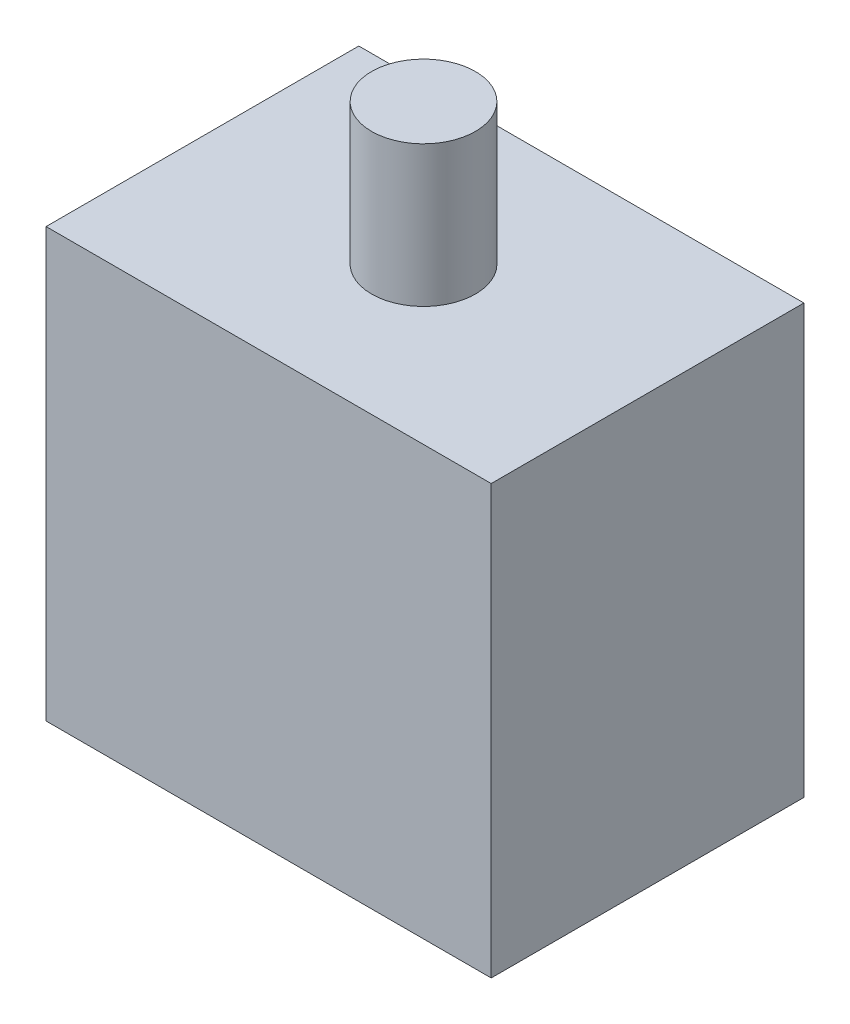
from build123d import *

# Parameters (mm, degrees)
SKETCH1_W           = 80.264
SKETCH1_H           = 56.388
BOSS_EXTRUDE1_DEPTH = 77.216
SKETCH2_R           = 9.361396041
BOSS_EXTRUDE2_DEPTH = 25.4


with BuildPart() as part:
    # Sketch1 → Boss-Extrude1 (new body)
    with BuildSketch(Plane(origin=(0, 0, 0), x_dir=(1, 0, 0), z_dir=(0, 1, 0))):
        with Locations((-40.132, 28.194)):
            Rectangle(SKETCH1_W, SKETCH1_H)
    extrude(amount=BOSS_EXTRUDE1_DEPTH)

    # Sketch2 → Boss-Extrude2 (add)
    with BuildSketch(Plane(origin=(0, 77.216, 0), x_dir=(1, 0, 0), z_dir=(0, 1, 0))):
        with Locations(Location((-40.36916368, 28.16435454, 0), (0, 0, 270))):
            Circle(SKETCH2_R)
    extrude(amount=BOSS_EXTRUDE2_DEPTH)


solid = part.part
